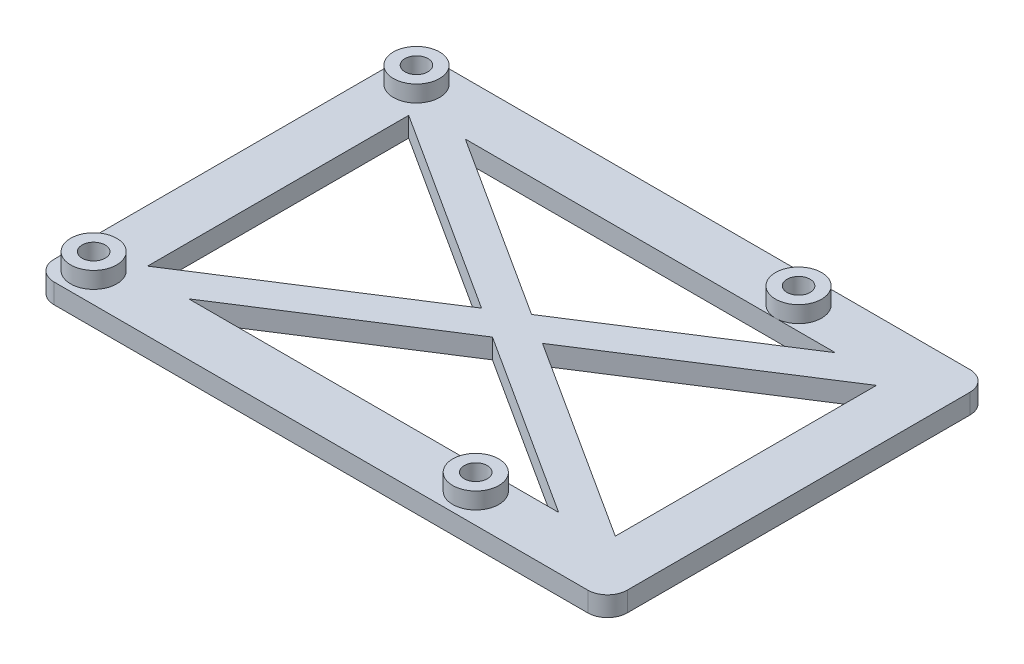
from build123d import *

# Parameters (mm, degrees)
CROQUIS1_W              = 87
CROQUIS1_H              = 58
SALIENTE_EXTRUIR1_DEPTH = 3
CROQUIS2_R              = 1.75
CORTAR_EXTRUIR1_DEPTH   = 53.366496923
CROQUIS3_R              = 3.5
CROQUIS3_R_2            = 1.75
SALIENTE_EXTRUIR2_DEPTH = 2.5
REDONDEO1_R             = 3
CORTAR_EXTRUIR2_DEPTH   = 53.569002273


with BuildPart() as part:
    # Croquis1 → Saliente-Extruir1 (new body)
    with BuildSketch(Plane(origin=(0, 0, 0), x_dir=(1, 0, 0), z_dir=(0, 1, 0))):
        Rectangle(CROQUIS1_W, CROQUIS1_H)
    extrude(amount=SALIENTE_EXTRUIR1_DEPTH)

    # Croquis2 → Cortar-Extruir1 (cut, through all)
    with BuildSketch(Plane.XZ):
        with Locations(Location((-39, -24.5, 0), (0, 0, 270))):
            Circle(CROQUIS2_R)
        with Locations(Location((-39, 24.5, 0), (0, 0, 270))):
            Circle(CROQUIS2_R)
        with Locations(Location((19, 24.5, 0), (0, 0, 270))):
            Circle(CROQUIS2_R)
        with Locations(Location((19, -24.5, 0), (0, 0, 270))):
            Circle(CROQUIS2_R)
    extrude(amount=-CORTAR_EXTRUIR1_DEPTH, mode=Mode.SUBTRACT)

    # Croquis3 → Saliente-Extruir2 (add)
    # profile 1 of 2: a face of its own
    with BuildSketch(Plane(origin=(0, 3, 0), x_dir=(1, 0, 0), z_dir=(0, 1, 0))):
        with Locations(Location((-39, 24.5, 0), (0, 0, 270))):
            Circle(CROQUIS3_R)
        with Locations(Location((-39, 24.5, 0), (0, 0, 90))):
            Circle(CROQUIS3_R_2, mode=Mode.SUBTRACT)
    # profile 2 of 2: a face of its own
    with BuildSketch(Plane(origin=(0, 3, 0), x_dir=(1, 0, 0), z_dir=(0, 1, 0))):
        with Locations(Location((19, 24.5, 0), (0, 0, 270))):
            Circle(CROQUIS3_R)
        with Locations(Location((19, 24.5, 0), (0, 0, 90))):
            Circle(CROQUIS3_R_2, mode=Mode.SUBTRACT)
    saliente_extruir2 = extrude(amount=SALIENTE_EXTRUIR2_DEPTH)

    # Simetría1: Saliente-Extruir2 across plane
    add(saliente_extruir2.mirror(Plane.XY))

    # Redondeo1
    redondeo1_edges = [part.edges().sort_by_distance(p)[0] for p in [
        (-43.5, 1.5, -29),
        (43.5, 1.5, -29),
        (43.5, 1.5, 29),
        (-43.5, 1.5, 29),
    ]]
    fillet(redondeo1_edges, radius=REDONDEO1_R)

    # Croquis4 → Cortar-Extruir2 (cut, through all)
    with BuildSketch(Plane.XZ):
        Polygon((28.08390048, 21), (0, 2.970829321), (-28.08390048, 21), align=None)
        Polygon((35.5, 19.819294136), (35.5, -19.819294136), (4.627637981, 0), align=None)
        Polygon((0, -2.970829321), (-28.08390048, -21), (28.08390048, -21), align=None)
        Polygon((-35.5, -19.819294136), (-35.5, 19.819294136), (-4.627637981, 0), align=None)
    extrude(amount=-CORTAR_EXTRUIR2_DEPTH, mode=Mode.SUBTRACT)


solid = part.part
